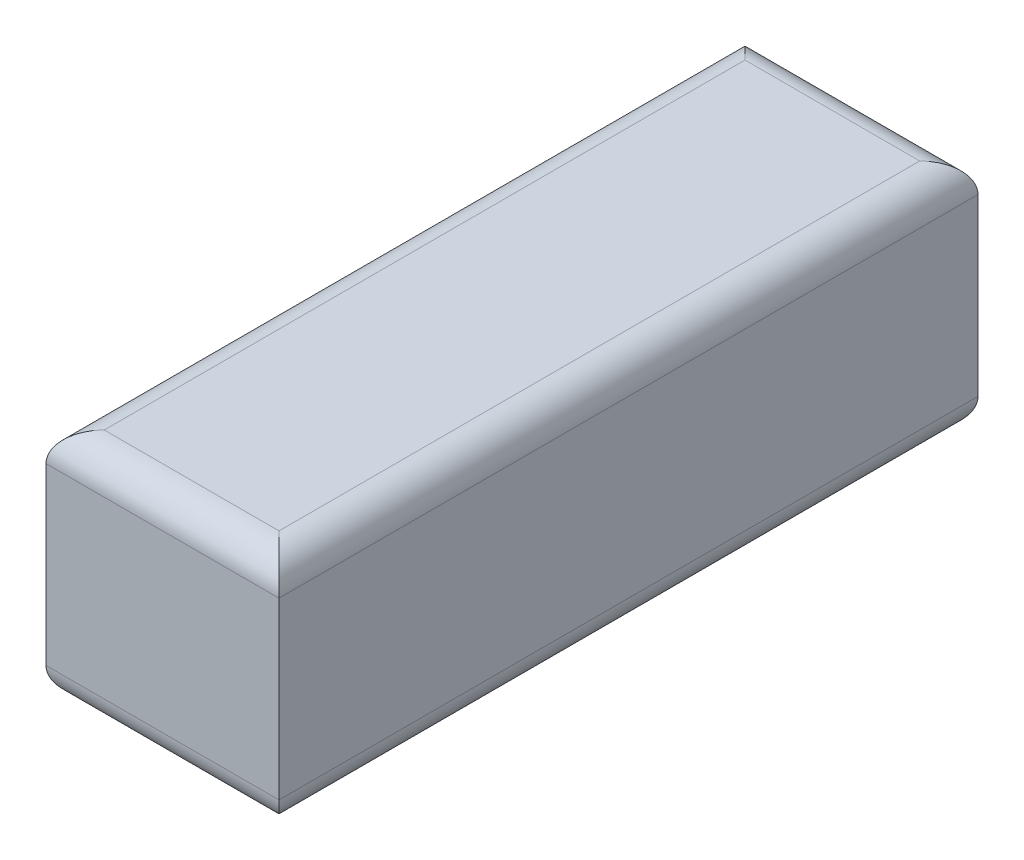
from build123d import *

# Parameters (mm, degrees)
SKETCH1_W           = 609.6
SKETCH1_H           = 609.6
BOSS_EXTRUDE1_DEPTH = 1828.8
FILLET1_R           = 76.2


with BuildPart() as part:
    # Sketch1 → Boss-Extrude1 (new body)
    with BuildSketch(Plane.XY):
        Rectangle(SKETCH1_W, SKETCH1_H)
    extrude(amount=BOSS_EXTRUDE1_DEPTH)

    # Fillet1
    fillet1_edges = [part.edges().sort_by_distance(p)[0] for p in [
        (0, 304.8, 1828.8),
        (0, 304.8, 0),
        (0, -304.8, 0),
        (-304.8, 304.8, 914.4),
        (304.8, 304.8, 914.4),
        (304.8, -304.8, 914.4),
        (-304.8, -304.8, 914.4),
        (0, -304.8, 1828.8),
    ]]
    fillet(fillet1_edges, radius=FILLET1_R)


solid = part.part
